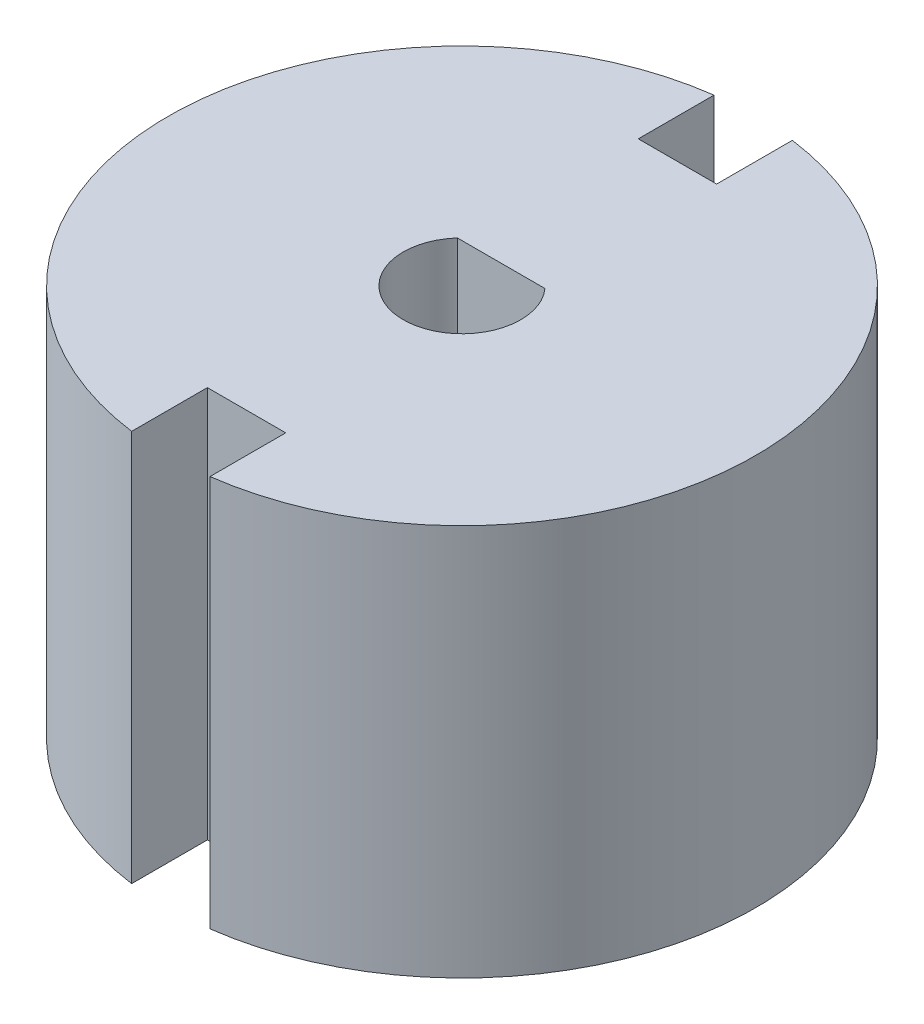
from build123d import *

# Parameters (mm, degrees)
EXTRUDE_1_DEPTH = 10


with BuildPart() as part:
    # Эскиз1 → Бобышка-Вытянуть1 (new body)
    # profile 1 of 2: a face of its own
    with BuildSketch(Plane(origin=(0, 0, 0), x_dir=(1, 0, 0), z_dir=(0, 1, 0))):
        with BuildLine():
            Line((-1, 5.5), (-1, 7.433034374))
            ThreePointArc((-1, 7.433034374), (-7.5, 0), (-1, -7.433034374))
            Line((-1, -7.433034374), (-1, -5.5))
            Line((-1, -5.5), (1, -5.5))
            Line((1, -5.5), (1, -7.433034374))
            ThreePointArc((1, -7.433034374), (5.645794895, -4.937104415), (7.5, 0))
            ThreePointArc((7.5, 0), (5.645794895, 4.937104415), (1, 7.433034374))
            Line((1, 7.433034374), (1, 5.5))
            Line((1, 5.5), (-1, 5.5))
        make_face()
        with BuildLine():
            ThreePointArc((1.5, 0), (-0.535233135, -1.401258538), (-1.118033989, 1))
            ThreePointArc((-1.118033989, 1), (0, 1.5), (1.118033989, 1))
            ThreePointArc((1.118033989, 1), (1.401258538, 0.535233135), (1.5, 0))
        make_face(mode=Mode.SUBTRACT)
    # profile 2 of 2: a face of its own
    with BuildSketch(Plane(origin=(0, 0, 0), x_dir=(1, 0, 0), z_dir=(0, 1, 0))):
        with BuildLine():
            ThreePointArc((1.118033989, 1), (0, 1.5), (-1.118033989, 1))
            Line((-1.118033989, 1), (1.118033989, 1))
        make_face()
    extrude(amount=EXTRUDE_1_DEPTH)


solid = part.part
